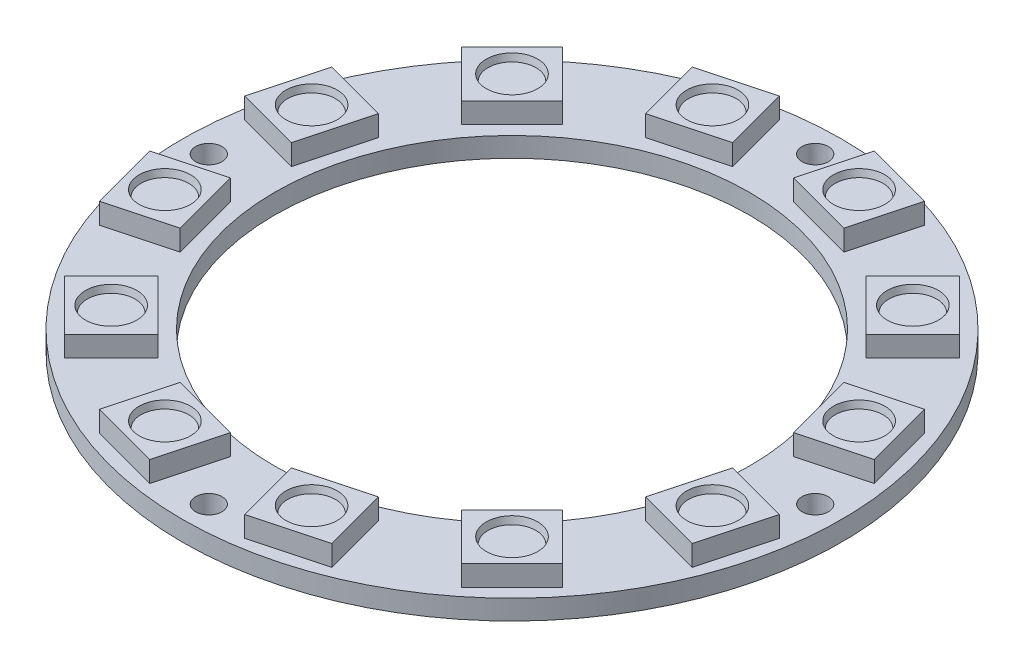
from build123d import *

# Parameters (mm, degrees)
CONTOUR_W                                   = 7
CONTOUR_H                                   = 1.5
BOSS_EXTRU_2_RGB_DEL_DEPTH                  = 1.57
R_P_TITION_CIRCULAIRE1_RGB_DEL_COUNT        = 12
BEIGNETS_SOUDURES_R                         = 0.875
BOSS_EXTRU_3_BEIGNETS_SOUDURES_DEPTH        = 0.0348
LENTILLE_R                                  = 1.95
ENL_V_MAT_EXTRU_1_LENTILLE_DEPTH            = 0.5
ENL_V_MAT_EXTRU_1_LENTILLE_DRAFT            = -15
R_P_TITION_CIRCULAIRE1_COPY_1_SKETCH_R      = 1.95
R_P_TITION_CIRCULAIRE1_COPY_1_DEPTH         = 0.5
R_P_TITION_CIRCULAIRE1_COPY_1_DRAFT         = -15
R_P_TITION_CIRCULAIRE1_COPY_2_SKETCH_R      = 1.95
R_P_TITION_CIRCULAIRE1_COPY_2_DEPTH         = 0.5
R_P_TITION_CIRCULAIRE1_COPY_2_DRAFT         = -15
R_P_TITION_CIRCULAIRE1_COPY_3_SKETCH_R      = 1.95
R_P_TITION_CIRCULAIRE1_COPY_3_DEPTH         = 0.5
R_P_TITION_CIRCULAIRE1_COPY_3_DRAFT         = -15
R_P_TITION_CIRCULAIRE1_COPY_4_SKETCH_R      = 1.95
R_P_TITION_CIRCULAIRE1_COPY_4_DEPTH         = 0.5
R_P_TITION_CIRCULAIRE1_COPY_4_DRAFT         = -15
R_P_TITION_CIRCULAIRE1_COPY_5_SKETCH_R      = 1.95
R_P_TITION_CIRCULAIRE1_COPY_5_DEPTH         = 0.5
R_P_TITION_CIRCULAIRE1_COPY_5_DRAFT         = -15
R_P_TITION_CIRCULAIRE1_COPY_6_SKETCH_R      = 1.95
R_P_TITION_CIRCULAIRE1_COPY_6_DEPTH         = 0.5
R_P_TITION_CIRCULAIRE1_COPY_6_DRAFT         = -15
R_P_TITION_CIRCULAIRE1_COPY_7_SKETCH_R      = 1.95
R_P_TITION_CIRCULAIRE1_COPY_7_DEPTH         = 0.5
R_P_TITION_CIRCULAIRE1_COPY_7_DRAFT         = -15
R_P_TITION_CIRCULAIRE1_COPY_8_SKETCH_R      = 1.95
R_P_TITION_CIRCULAIRE1_COPY_8_DEPTH         = 0.5
R_P_TITION_CIRCULAIRE1_COPY_8_DRAFT         = -15
R_P_TITION_CIRCULAIRE1_COPY_9_SKETCH_R      = 1.95
R_P_TITION_CIRCULAIRE1_COPY_9_DEPTH         = 0.5
R_P_TITION_CIRCULAIRE1_COPY_9_DRAFT         = -15
R_P_TITION_CIRCULAIRE1_COPY_10_SKETCH_R     = 1.95
R_P_TITION_CIRCULAIRE1_COPY_10_DEPTH        = 0.5
R_P_TITION_CIRCULAIRE1_COPY_10_DRAFT        = -15
R_P_TITION_CIRCULAIRE1_COPY_11_SKETCH_R     = 1.95
R_P_TITION_CIRCULAIRE1_COPY_11_DEPTH        = 0.5
R_P_TITION_CIRCULAIRE1_COPY_11_DRAFT        = -15
TOUS_MONTAGE_VIS_M2_ANNEAU_RGB_R            = 1
ENL_V_MAT_EXTRU_1_TOUS_MONTAGE_VIS_M2_DEPTH = 2.5


with BuildPart() as part:
    # Contour → Révolution1_Contour (revolve)
    with BuildSketch(Plane.XY, mode=Mode.PRIVATE) as r_volution1_contour_sk:
        with Locations((21.5, 0)):
            Rectangle(CONTOUR_W, CONTOUR_H)
    revolve(r_volution1_contour_sk.sketch.rotate(Axis((0, 2.47524, 0), (0, -1, 0)), 90), axis=Axis((0, 2.47524, 0), (0, -1, 0)))

    # RGB_DEL → Boss.-Extru.2_RGB_DEL (add)
    with BuildSketch(Plane(origin=(0, 0.75, 0), x_dir=(1, 0, 0), z_dir=(0, 1, 0))):
        Polygon((-15.344217152, 11.525840533), (-11.525840533, 15.344217152), (-15.061374439, 18.879751058), (-18.879751058, 15.061374439), align=None)
    boss_extru_2_rgb_del = extrude(amount=BOSS_EXTRU_2_RGB_DEL_DEPTH)

    # Répétition circulaire1_RGB_DEL: Boss.-Extru.2_RGB_DEL ×12 about axis
    r_p_tition_circulaire1_rgb_del_axis = Axis((0, 0, 0), (0, 1, 0))
    for i in range(1, R_P_TITION_CIRCULAIRE1_RGB_DEL_COUNT):
        add(boss_extru_2_rgb_del.rotate(r_p_tition_circulaire1_rgb_del_axis, i * 360 / R_P_TITION_CIRCULAIRE1_RGB_DEL_COUNT))

    # Beignets_soudures → Boss.-Extru.3_Beignets_soudures (add)
    with BuildSketch(Plane(origin=(0, -0.75, 0), x_dir=(-1, 0, 0), z_dir=(0, -1, 0))):
        with Locations(Location((12.508718959, 17.896872632, 0), (0, 0, 270))):
            Circle(BEIGNETS_SOUDURES_R)
        with Locations(Location((14.304770183, 16.100821408, 0), (0, 0, 270))):
            Circle(BEIGNETS_SOUDURES_R)
        with Locations(Location((16.100821408, 14.304770183, 0), (0, 0, 270))):
            Circle(BEIGNETS_SOUDURES_R)
        with Locations(Location((17.896872632, 12.508718959, 0), (0, 0, 270))):
            Circle(BEIGNETS_SOUDURES_R)
    extrude(amount=BOSS_EXTRU_3_BEIGNETS_SOUDURES_DEPTH)


with BuildPart() as enl_v_mat_extru_1_lentille_tool:
    # Lentille → Enlèv. mat.-Extru.1_Lentille (with draft: the straight prism first)
    with BuildSketch(Plane(origin=(0, 2.32, 0), x_dir=(1, 0, 0), z_dir=(0, 1, 0))):
        with Locations((-15.202795796, 15.202795796)):
            Circle(LENTILLE_R)
    extrude(amount=-ENL_V_MAT_EXTRU_1_LENTILLE_DEPTH)
    # Enlèv. mat.-Extru.1_Lentille: the draft: its side faces are tilted about the plane it starts from
    enl_v_mat_extru_1_lentille_sides = [enl_v_mat_extru_1_lentille_tool.faces().sort_by_distance(p)[0] for p in [
        (-17.152795796, 2.07, -15.202795796),
    ]]
    draft(enl_v_mat_extru_1_lentille_sides, Plane(origin=(0, 2.32, 0), x_dir=(1, 0, 0), z_dir=(0, 1, 0)), ENL_V_MAT_EXTRU_1_LENTILLE_DRAFT)


with BuildPart() as part_1:
    add(part.part)

    # Enlèv. mat.-Extru.1_Lentille: cut by enl_v_mat_extru_1_lentille_tool
    add(enl_v_mat_extru_1_lentille_tool.part, mode=Mode.SUBTRACT)


with BuildPart() as r_p_tition_circulaire1_copy_1_tool:
    # Répétition circulaire1 copy 1 sketch → Répétition circulaire1 copy 1 (with draft: the straight prism first)
    with BuildSketch(Plane(origin=(0, 2.32, 0), x_dir=(0.8660254037844387, 0, -0.49999999999999994), z_dir=(0, 1, 0))):
        with Locations((-15.202795796, 15.202795796)):
            Circle(R_P_TITION_CIRCULAIRE1_COPY_1_SKETCH_R)
    extrude(amount=-R_P_TITION_CIRCULAIRE1_COPY_1_DEPTH)
    # Répétition circulaire1 copy 1: the draft: its side faces are tilted about the plane it starts from
    r_p_tition_circulaire1_copy_1_sides = [r_p_tition_circulaire1_copy_1_tool.faces().sort_by_distance(p)[0] for p in [
        (-22.456154803, 2.07, -4.58960947),
    ]]
    draft(r_p_tition_circulaire1_copy_1_sides, Plane(origin=(0, 2.32, 0), x_dir=(0.8660254037844387, 0, -0.49999999999999994), z_dir=(0, 1, 0)), R_P_TITION_CIRCULAIRE1_COPY_1_DRAFT)


with BuildPart() as part_2:
    add(part_1.part)

    # Répétition circulaire1 copy 1: cut by r_p_tition_circulaire1_copy_1_tool
    add(r_p_tition_circulaire1_copy_1_tool.part, mode=Mode.SUBTRACT)


with BuildPart() as r_p_tition_circulaire1_copy_2_tool:
    # Répétition circulaire1 copy 2 sketch → Répétition circulaire1 copy 2 (with draft: the straight prism first)
    with BuildSketch(Plane(origin=(0, 2.32, 0), x_dir=(0.5000000000000001, 0, -0.8660254037844386), z_dir=(0, 1, 0))):
        with Locations((-15.202795796, 15.202795796)):
            Circle(R_P_TITION_CIRCULAIRE1_COPY_2_SKETCH_R)
    extrude(amount=-R_P_TITION_CIRCULAIRE1_COPY_2_DEPTH)
    # Répétition circulaire1 copy 2: the draft: its side faces are tilted about the plane it starts from
    r_p_tition_circulaire1_copy_2_sides = [r_p_tition_circulaire1_copy_2_tool.faces().sort_by_distance(p)[0] for p in [
        (-21.742405266, 2.07, 7.253359007),
    ]]
    draft(r_p_tition_circulaire1_copy_2_sides, Plane(origin=(0, 2.32, 0), x_dir=(0.5000000000000001, 0, -0.8660254037844386), z_dir=(0, 1, 0)), R_P_TITION_CIRCULAIRE1_COPY_2_DRAFT)


with BuildPart() as part_3:
    add(part_2.part)

    # Répétition circulaire1 copy 2: cut by r_p_tition_circulaire1_copy_2_tool
    add(r_p_tition_circulaire1_copy_2_tool.part, mode=Mode.SUBTRACT)


with BuildPart() as r_p_tition_circulaire1_copy_3_tool:
    # Répétition circulaire1 copy 3 sketch → Répétition circulaire1 copy 3 (with draft: the straight prism first)
    with BuildSketch(Plane(origin=(0, 2.32, 0), x_dir=(0, 0, -1), z_dir=(0, 1, 0))):
        with Locations((-15.202795796, 15.202795796)):
            Circle(R_P_TITION_CIRCULAIRE1_COPY_3_SKETCH_R)
    extrude(amount=-R_P_TITION_CIRCULAIRE1_COPY_3_DEPTH)
    # Répétition circulaire1 copy 3: the draft: its side faces are tilted about the plane it starts from
    r_p_tition_circulaire1_copy_3_sides = [r_p_tition_circulaire1_copy_3_tool.faces().sort_by_distance(p)[0] for p in [
        (-15.202795796, 2.07, 17.152795796),
    ]]
    draft(r_p_tition_circulaire1_copy_3_sides, Plane(origin=(0, 2.32, 0), x_dir=(0, 0, -1), z_dir=(0, 1, 0)), R_P_TITION_CIRCULAIRE1_COPY_3_DRAFT)


with BuildPart() as part_4:
    add(part_3.part)

    # Répétition circulaire1 copy 3: cut by r_p_tition_circulaire1_copy_3_tool
    add(r_p_tition_circulaire1_copy_3_tool.part, mode=Mode.SUBTRACT)


with BuildPart() as r_p_tition_circulaire1_copy_4_tool:
    # Répétition circulaire1 copy 4 sketch → Répétition circulaire1 copy 4 (with draft: the straight prism first)
    with BuildSketch(Plane(origin=(0, 2.32, 0), x_dir=(-0.4999999999999998, 0, -0.8660254037844387), z_dir=(0, 1, 0))):
        with Locations((-15.202795796, 15.202795796)):
            Circle(R_P_TITION_CIRCULAIRE1_COPY_4_SKETCH_R)
    extrude(amount=-R_P_TITION_CIRCULAIRE1_COPY_4_DEPTH)
    # Répétition circulaire1 copy 4: the draft: its side faces are tilted about the plane it starts from
    r_p_tition_circulaire1_copy_4_sides = [r_p_tition_circulaire1_copy_4_tool.faces().sort_by_distance(p)[0] for p in [
        (-4.58960947, 2.07, 22.456154803),
    ]]
    draft(r_p_tition_circulaire1_copy_4_sides, Plane(origin=(0, 2.32, 0), x_dir=(-0.4999999999999998, 0, -0.8660254037844387), z_dir=(0, 1, 0)), R_P_TITION_CIRCULAIRE1_COPY_4_DRAFT)


with BuildPart() as part_5:
    add(part_4.part)

    # Répétition circulaire1 copy 4: cut by r_p_tition_circulaire1_copy_4_tool
    add(r_p_tition_circulaire1_copy_4_tool.part, mode=Mode.SUBTRACT)


with BuildPart() as r_p_tition_circulaire1_copy_5_tool:
    # Répétition circulaire1 copy 5 sketch → Répétition circulaire1 copy 5 (with draft: the straight prism first)
    with BuildSketch(Plane(origin=(0, 2.32, 0), x_dir=(-0.8660254037844387, 0, -0.49999999999999994), z_dir=(0, 1, 0))):
        with Locations((-15.202795796, 15.202795796)):
            Circle(R_P_TITION_CIRCULAIRE1_COPY_5_SKETCH_R)
    extrude(amount=-R_P_TITION_CIRCULAIRE1_COPY_5_DEPTH)
    # Répétition circulaire1 copy 5: the draft: its side faces are tilted about the plane it starts from
    r_p_tition_circulaire1_copy_5_sides = [r_p_tition_circulaire1_copy_5_tool.faces().sort_by_distance(p)[0] for p in [
        (7.253359007, 2.07, 21.742405266),
    ]]
    draft(r_p_tition_circulaire1_copy_5_sides, Plane(origin=(0, 2.32, 0), x_dir=(-0.8660254037844387, 0, -0.49999999999999994), z_dir=(0, 1, 0)), R_P_TITION_CIRCULAIRE1_COPY_5_DRAFT)


with BuildPart() as part_6:
    add(part_5.part)

    # Répétition circulaire1 copy 5: cut by r_p_tition_circulaire1_copy_5_tool
    add(r_p_tition_circulaire1_copy_5_tool.part, mode=Mode.SUBTRACT)


with BuildPart() as r_p_tition_circulaire1_copy_6_tool:
    # Répétition circulaire1 copy 6 sketch → Répétition circulaire1 copy 6 (with draft: the straight prism first)
    with BuildSketch(Plane(origin=(0, 2.32, 0), x_dir=(-1, 0, 0), z_dir=(0, 1, 0))):
        with Locations((-15.202795796, 15.202795796)):
            Circle(R_P_TITION_CIRCULAIRE1_COPY_6_SKETCH_R)
    extrude(amount=-R_P_TITION_CIRCULAIRE1_COPY_6_DEPTH)
    # Répétition circulaire1 copy 6: the draft: its side faces are tilted about the plane it starts from
    r_p_tition_circulaire1_copy_6_sides = [r_p_tition_circulaire1_copy_6_tool.faces().sort_by_distance(p)[0] for p in [
        (17.152795796, 2.07, 15.202795796),
    ]]
    draft(r_p_tition_circulaire1_copy_6_sides, Plane(origin=(0, 2.32, 0), x_dir=(-1, 0, 0), z_dir=(0, 1, 0)), R_P_TITION_CIRCULAIRE1_COPY_6_DRAFT)


with BuildPart() as part_7:
    add(part_6.part)

    # Répétition circulaire1 copy 6: cut by r_p_tition_circulaire1_copy_6_tool
    add(r_p_tition_circulaire1_copy_6_tool.part, mode=Mode.SUBTRACT)


with BuildPart() as r_p_tition_circulaire1_copy_7_tool:
    # Répétition circulaire1 copy 7 sketch → Répétition circulaire1 copy 7 (with draft: the straight prism first)
    with BuildSketch(Plane(origin=(0, 2.32, 0), x_dir=(-0.8660254037844386, 0, 0.5000000000000001), z_dir=(0, 1, 0))):
        with Locations((-15.202795796, 15.202795796)):
            Circle(R_P_TITION_CIRCULAIRE1_COPY_7_SKETCH_R)
    extrude(amount=-R_P_TITION_CIRCULAIRE1_COPY_7_DEPTH)
    # Répétition circulaire1 copy 7: the draft: its side faces are tilted about the plane it starts from
    r_p_tition_circulaire1_copy_7_sides = [r_p_tition_circulaire1_copy_7_tool.faces().sort_by_distance(p)[0] for p in [
        (22.456154803, 2.07, 4.58960947),
    ]]
    draft(r_p_tition_circulaire1_copy_7_sides, Plane(origin=(0, 2.32, 0), x_dir=(-0.8660254037844386, 0, 0.5000000000000001), z_dir=(0, 1, 0)), R_P_TITION_CIRCULAIRE1_COPY_7_DRAFT)


with BuildPart() as part_8:
    add(part_7.part)

    # Répétition circulaire1 copy 7: cut by r_p_tition_circulaire1_copy_7_tool
    add(r_p_tition_circulaire1_copy_7_tool.part, mode=Mode.SUBTRACT)


with BuildPart() as r_p_tition_circulaire1_copy_8_tool:
    # Répétition circulaire1 copy 8 sketch → Répétition circulaire1 copy 8 (with draft: the straight prism first)
    with BuildSketch(Plane(origin=(0, 2.32, 0), x_dir=(-0.5000000000000004, 0, 0.8660254037844384), z_dir=(0, 1, 0))):
        with Locations((-15.202795796, 15.202795796)):
            Circle(R_P_TITION_CIRCULAIRE1_COPY_8_SKETCH_R)
    extrude(amount=-R_P_TITION_CIRCULAIRE1_COPY_8_DEPTH)
    # Répétition circulaire1 copy 8: the draft: its side faces are tilted about the plane it starts from
    r_p_tition_circulaire1_copy_8_sides = [r_p_tition_circulaire1_copy_8_tool.faces().sort_by_distance(p)[0] for p in [
        (21.742405266, 2.07, -7.253359007),
    ]]
    draft(r_p_tition_circulaire1_copy_8_sides, Plane(origin=(0, 2.32, 0), x_dir=(-0.5000000000000004, 0, 0.8660254037844384), z_dir=(0, 1, 0)), R_P_TITION_CIRCULAIRE1_COPY_8_DRAFT)


with BuildPart() as part_9:
    add(part_8.part)

    # Répétition circulaire1 copy 8: cut by r_p_tition_circulaire1_copy_8_tool
    add(r_p_tition_circulaire1_copy_8_tool.part, mode=Mode.SUBTRACT)


with BuildPart() as r_p_tition_circulaire1_copy_9_tool:
    # Répétition circulaire1 copy 9 sketch → Répétition circulaire1 copy 9 (with draft: the straight prism first)
    with BuildSketch(Plane.ZX.offset(2.32)):
        with Locations((-15.202795796, 15.202795796)):
            Circle(R_P_TITION_CIRCULAIRE1_COPY_9_SKETCH_R)
    extrude(amount=-R_P_TITION_CIRCULAIRE1_COPY_9_DEPTH)
    # Répétition circulaire1 copy 9: the draft: its side faces are tilted about the plane it starts from
    r_p_tition_circulaire1_copy_9_sides = [r_p_tition_circulaire1_copy_9_tool.faces().sort_by_distance(p)[0] for p in [
        (15.202795796, 2.07, -17.152795796),
    ]]
    draft(r_p_tition_circulaire1_copy_9_sides, Plane.ZX.offset(2.32), R_P_TITION_CIRCULAIRE1_COPY_9_DRAFT)


with BuildPart() as part_10:
    add(part_9.part)

    # Répétition circulaire1 copy 9: cut by r_p_tition_circulaire1_copy_9_tool
    add(r_p_tition_circulaire1_copy_9_tool.part, mode=Mode.SUBTRACT)


with BuildPart() as r_p_tition_circulaire1_copy_10_tool:
    # Répétition circulaire1 copy 10 sketch → Répétition circulaire1 copy 10 (with draft: the straight prism first)
    with BuildSketch(Plane(origin=(0, 2.32, 0), x_dir=(0.5000000000000001, 0, 0.8660254037844386), z_dir=(0, 1, 0))):
        with Locations((-15.202795796, 15.202795796)):
            Circle(R_P_TITION_CIRCULAIRE1_COPY_10_SKETCH_R)
    extrude(amount=-R_P_TITION_CIRCULAIRE1_COPY_10_DEPTH)
    # Répétition circulaire1 copy 10: the draft: its side faces are tilted about the plane it starts from
    r_p_tition_circulaire1_copy_10_sides = [r_p_tition_circulaire1_copy_10_tool.faces().sort_by_distance(p)[0] for p in [
        (4.58960947, 2.07, -22.456154803),
    ]]
    draft(r_p_tition_circulaire1_copy_10_sides, Plane(origin=(0, 2.32, 0), x_dir=(0.5000000000000001, 0, 0.8660254037844386), z_dir=(0, 1, 0)), R_P_TITION_CIRCULAIRE1_COPY_10_DRAFT)


with BuildPart() as part_11:
    add(part_10.part)

    # Répétition circulaire1 copy 10: cut by r_p_tition_circulaire1_copy_10_tool
    add(r_p_tition_circulaire1_copy_10_tool.part, mode=Mode.SUBTRACT)


with BuildPart() as r_p_tition_circulaire1_copy_11_tool:
    # Répétition circulaire1 copy 11 sketch → Répétition circulaire1 copy 11 (with draft: the straight prism first)
    with BuildSketch(Plane(origin=(0, 2.32, 0), x_dir=(0.8660254037844384, 0, 0.5000000000000004), z_dir=(0, 1, 0))):
        with Locations((-15.202795796, 15.202795796)):
            Circle(R_P_TITION_CIRCULAIRE1_COPY_11_SKETCH_R)
    extrude(amount=-R_P_TITION_CIRCULAIRE1_COPY_11_DEPTH)
    # Répétition circulaire1 copy 11: the draft: its side faces are tilted about the plane it starts from
    r_p_tition_circulaire1_copy_11_sides = [r_p_tition_circulaire1_copy_11_tool.faces().sort_by_distance(p)[0] for p in [
        (-7.253359007, 2.07, -21.742405266),
    ]]
    draft(r_p_tition_circulaire1_copy_11_sides, Plane(origin=(0, 2.32, 0), x_dir=(0.8660254037844384, 0, 0.5000000000000004), z_dir=(0, 1, 0)), R_P_TITION_CIRCULAIRE1_COPY_11_DRAFT)


with BuildPart() as part_12:
    add(part_11.part)

    # Répétition circulaire1 copy 11: cut by r_p_tition_circulaire1_copy_11_tool
    add(r_p_tition_circulaire1_copy_11_tool.part, mode=Mode.SUBTRACT)

    # Tous_Montage_Vis_M2_Anneau_RGB → Enlèv. mat.-Extru.1_Tous_Montage_Vis_M2_Anneau_RGB (cut, symmetric)
    with BuildSketch(Plane(origin=(0, 0, 0), x_dir=(1, 0, 0), z_dir=(0, 1, 0))):
        with Locations(Location((-23, 0, 0), (0, 0, 270))):
            Circle(TOUS_MONTAGE_VIS_M2_ANNEAU_RGB_R)
        with Locations(Location((0, 23, 0), (0, 0, 270))):
            Circle(TOUS_MONTAGE_VIS_M2_ANNEAU_RGB_R)
        with Locations(Location((23, 0, 0), (0, 0, 270))):
            Circle(TOUS_MONTAGE_VIS_M2_ANNEAU_RGB_R)
        with Locations(Location((0, -23, 0), (0, 0, 270))):
            Circle(TOUS_MONTAGE_VIS_M2_ANNEAU_RGB_R)
    extrude(amount=ENL_V_MAT_EXTRU_1_TOUS_MONTAGE_VIS_M2_DEPTH, both=True, mode=Mode.SUBTRACT)


solid = part_12.part
